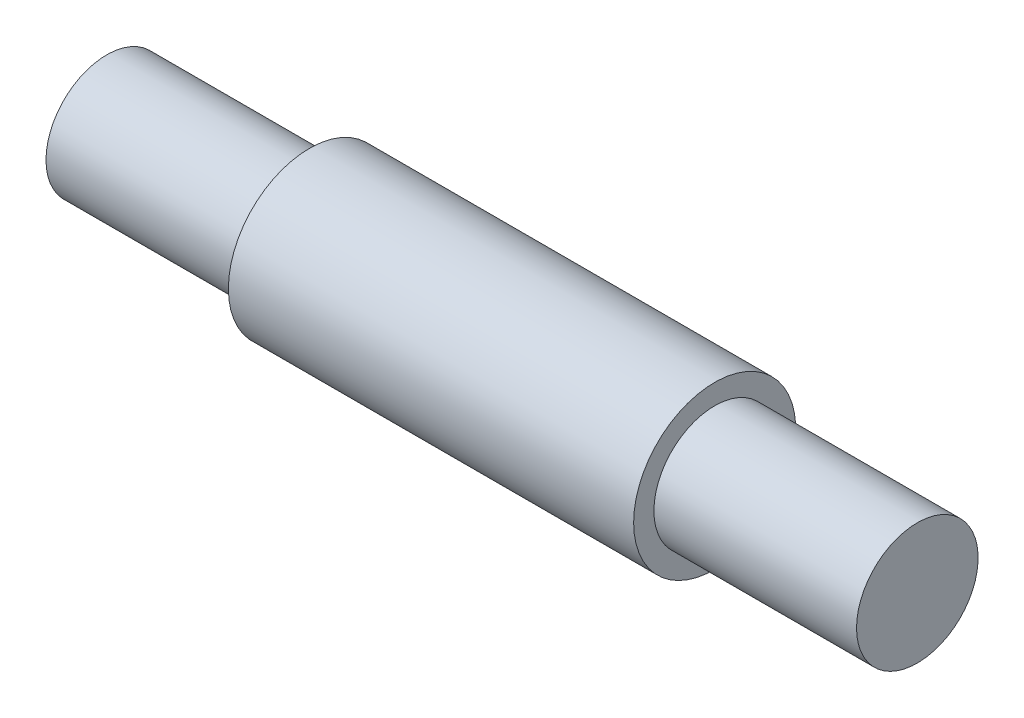
from build123d import *


with BuildPart() as part:
    # Sketch1 → Revolve1 (revolve)
    with BuildSketch(Plane.XY, mode=Mode.PRIVATE) as revolve1_sk:
        Polygon((-40, 0), (40, 0), (40, 6), (20, 6), (20, 8), (-20, 8), (-20, 6), (-40, 6), align=None)
    revolve(revolve1_sk.sketch.rotate(Axis((-50, 0, 0), (1, 0, 0)), 90), axis=Axis((-50, 0, 0), (1, 0, 0)))


solid = part.part
